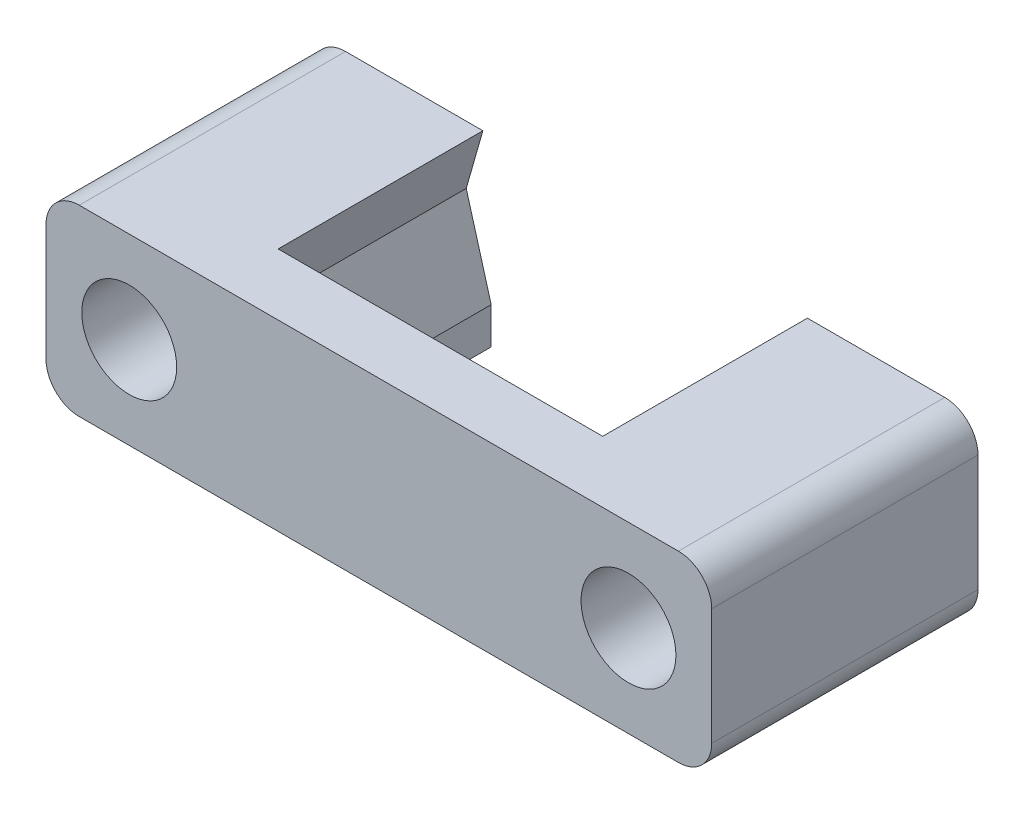
from build123d import *

# Parameters (mm, degrees)
SKETCH_1_W          = 40
SKETCH_1_H          = 11
SKETCH_1_R          = 1.6
EXTRUDE_1_DEPTH     = 14
CUT_EXTRUDE_1_DEPTH = 10.3
SKETCH_3_R          = 2.85
CUT_EXTRUDE_2_DEPTH = 5
EXTRUDE_START       = 2
SKETCH_4_R          = 1.6
EXTRUDE_2_DEPTH     = 2
FILLET_1_R          = 2


with BuildPart() as part:
    # 草图1 → 凸台-拉伸1 (new body)
    with BuildSketch(Plane.XY):
        with Locations((20, 5.5)):
            Rectangle(SKETCH_1_W, SKETCH_1_H)
        with Locations((5, 5.5)):
            Circle(SKETCH_1_R, mode=Mode.SUBTRACT)
        with Locations((35, 5.5)):
            Circle(SKETCH_1_R, mode=Mode.SUBTRACT)
    extrude(amount=EXTRUDE_1_DEPTH)

    # 草图2 → 切除-拉伸1 (cut)
    with BuildSketch(Plane(origin=(0, 0, 0), x_dir=(-1, 0, 0), z_dir=(0, 0, -1))):
        Polygon((-10.25, 11), (-20, 11), (-20, 0), (-10.75, 0), (-10.75, 2.2), (-9.25, 7.5), align=None)
        Polygon((-20, 11), (-29.75, 11), (-30.75, 7.5), (-29.25, 2.2), (-29.25, 0), (-20, 0), align=None)
    extrude(amount=-CUT_EXTRUDE_1_DEPTH, mode=Mode.SUBTRACT)

    # 草图3 → 切除-拉伸2 (cut)
    with BuildSketch(Plane.XY.offset(14)):
        with Locations((5, 5.5)):
            Circle(SKETCH_3_R)
        with Locations((35, 5.5)):
            Circle(SKETCH_3_R)
    extrude(amount=-CUT_EXTRUDE_2_DEPTH, mode=Mode.SUBTRACT)

    # 草图4 → 凸台-拉伸2 (add)
    # profile 1 of 2: a face of its own
    with BuildSketch(Plane(origin=(0, 0, 0), x_dir=(-1, 0, 0), z_dir=(0, 0, -1)).offset(EXTRUDE_START)):
        Polygon((-10.25, 11), (-9.25, 7.5), (-10.75, 2.2), (-10.75, 0), (0, 0), (0, 11), align=None)
        with Locations((-5, 5.5)):
            Circle(SKETCH_4_R, mode=Mode.SUBTRACT)
    # profile 2 of 2: a face of its own
    with BuildSketch(Plane(origin=(0, 0, 0), x_dir=(-1, 0, 0), z_dir=(0, 0, -1)).offset(EXTRUDE_START)):
        Polygon((-30.75, 7.5), (-29.75, 11), (-40, 11), (-40, 0), (-29.25, 0), (-29.25, 2.2), align=None)
        with Locations((-35, 5.5)):
            Circle(SKETCH_4_R, mode=Mode.SUBTRACT)
    extrude(amount=-EXTRUDE_2_DEPTH)

    # 圆角1
    fillet_1_edges = [part.edges().sort_by_distance(p)[0] for p in [
        (0, 11, 6),
        (40, 11, 6),
        (40, 0, 6),
        (0, 0, 6),
    ]]
    fillet(fillet_1_edges, radius=FILLET_1_R)


solid = part.part
